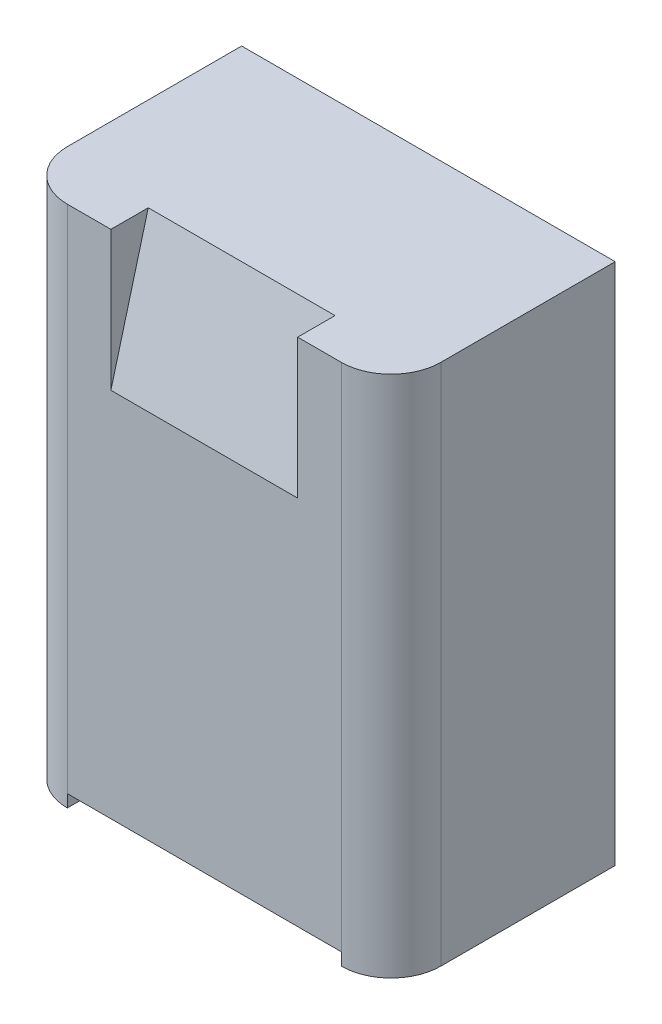
from build123d import *

# Parameters (mm, degrees)
SKETCH1_W           = 762
SKETCH1_H           = 1066.8
BOSS_EXTRUDE1_DEPTH = 228.6
FILLET1_R           = 101.6
SKETCH2_W           = 558.8
SKETCH2_H           = 25.4
CUT_EXTRUDE1_DEPTH  = 1222.578929091
CUT_EXTRUDE2_DEPTH  = 190.5


with BuildPart() as part:
    # Sketch1 → Boss-Extrude1 (new, symmetric)
    with BuildSketch(Plane.XY):
        with Locations((0, 533.4)):
            Rectangle(SKETCH1_W, SKETCH1_H)
    extrude(amount=BOSS_EXTRUDE1_DEPTH, both=True)

    # Fillet1
    fillet1_edges = [part.edges().sort_by_distance(p)[0] for p in [
        (381, 533.4, 228.6),
        (-381, 533.4, 228.6),
    ]]
    fillet(fillet1_edges, radius=FILLET1_R)

    # Sketch2 → Cut-Extrude1 (cut, through all)
    with BuildSketch(Plane.XY.offset(228.6)):
        with Locations((0, 12.7)):
            Rectangle(SKETCH2_W, SKETCH2_H)
    extrude(amount=-CUT_EXTRUDE1_DEPTH, mode=Mode.SUBTRACT)

    # Sketch3 → Cut-Extrude2 (cut, symmetric)
    with BuildSketch(Plane(origin=(0, 0, 0), x_dir=(0, 0, -1), z_dir=(1, 0, 0))):
        Polygon((-152.4, 1066.8), (-228.6, 782.417728463), (-228.6, 1066.8), align=None)
    extrude(amount=CUT_EXTRUDE2_DEPTH, both=True, mode=Mode.SUBTRACT)


solid = part.part
